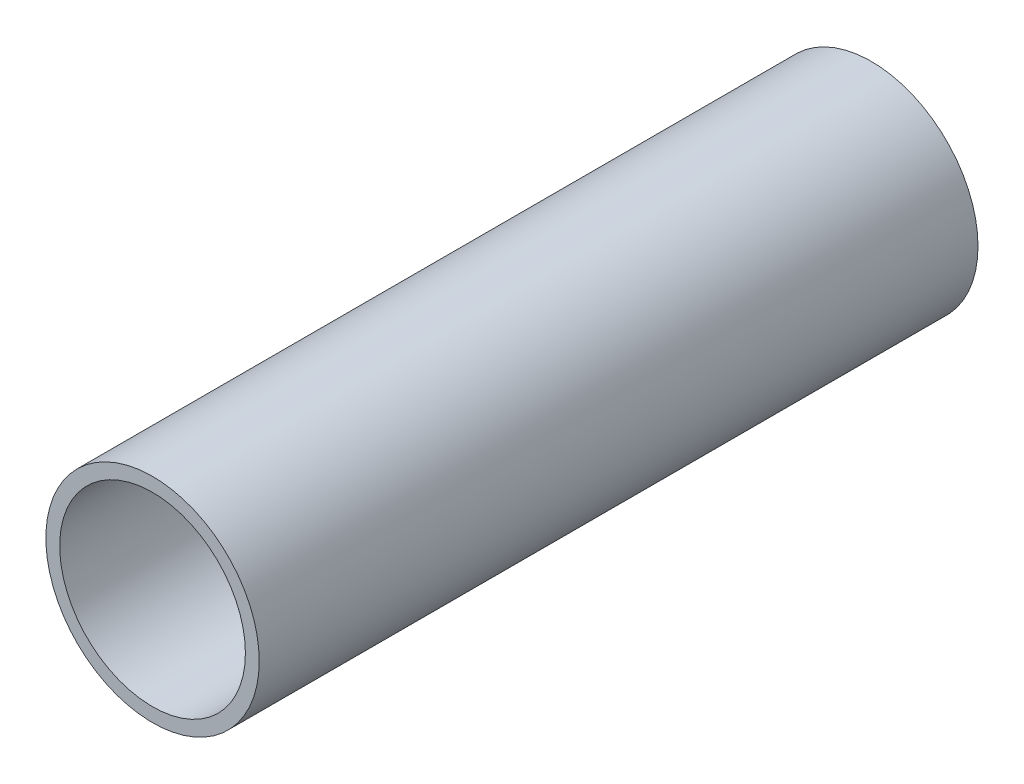
from build123d import *

# Parameters (mm, degrees)
SKETCH1_R           = 30.1625
SKETCH1_R_2         = 26.2509
BOSS_EXTRUDE1_DEPTH = 203.2


with BuildPart() as part:
    # Sketch1 → Boss-Extrude1 (new body)
    with BuildSketch(Plane.XY):
        Circle(SKETCH1_R)
        Circle(SKETCH1_R_2, mode=Mode.SUBTRACT)
    extrude(amount=BOSS_EXTRUDE1_DEPTH)


solid = part.part
